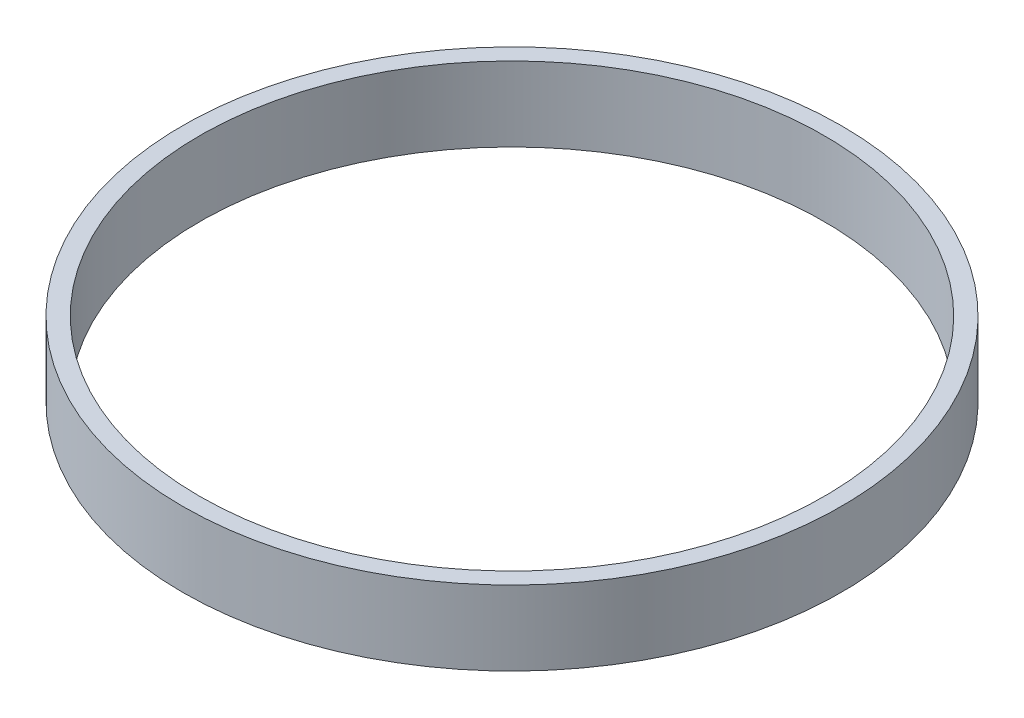
from build123d import *

# Parameters (mm, degrees)
SKETCH1_R           = 57.5
BOSS_EXTRUDE1_DEPTH = 13
SKETCH2_R           = 54.5
CUT_EXTRUDE1_DEPTH  = 13


with BuildPart() as part:
    # Sketch1 → Boss-Extrude1 (new body)
    with BuildSketch(Plane(origin=(0, 0, 0), x_dir=(1, 0, 0), z_dir=(0, 1, 0))):
        with Locations(Location((0, 0, 0), (0, 0, 90))):
            Circle(SKETCH1_R)
    extrude(amount=BOSS_EXTRUDE1_DEPTH)

    # Sketch2 → Cut-Extrude1 (cut)
    with BuildSketch(Plane(origin=(0, 13, 0), x_dir=(1, 0, 0), z_dir=(0, 1, 0))):
        with Locations(Location((0, 0, 0), (0, 0, 270))):
            Circle(SKETCH2_R)
    extrude(amount=-CUT_EXTRUDE1_DEPTH, mode=Mode.SUBTRACT)


solid = part.part
